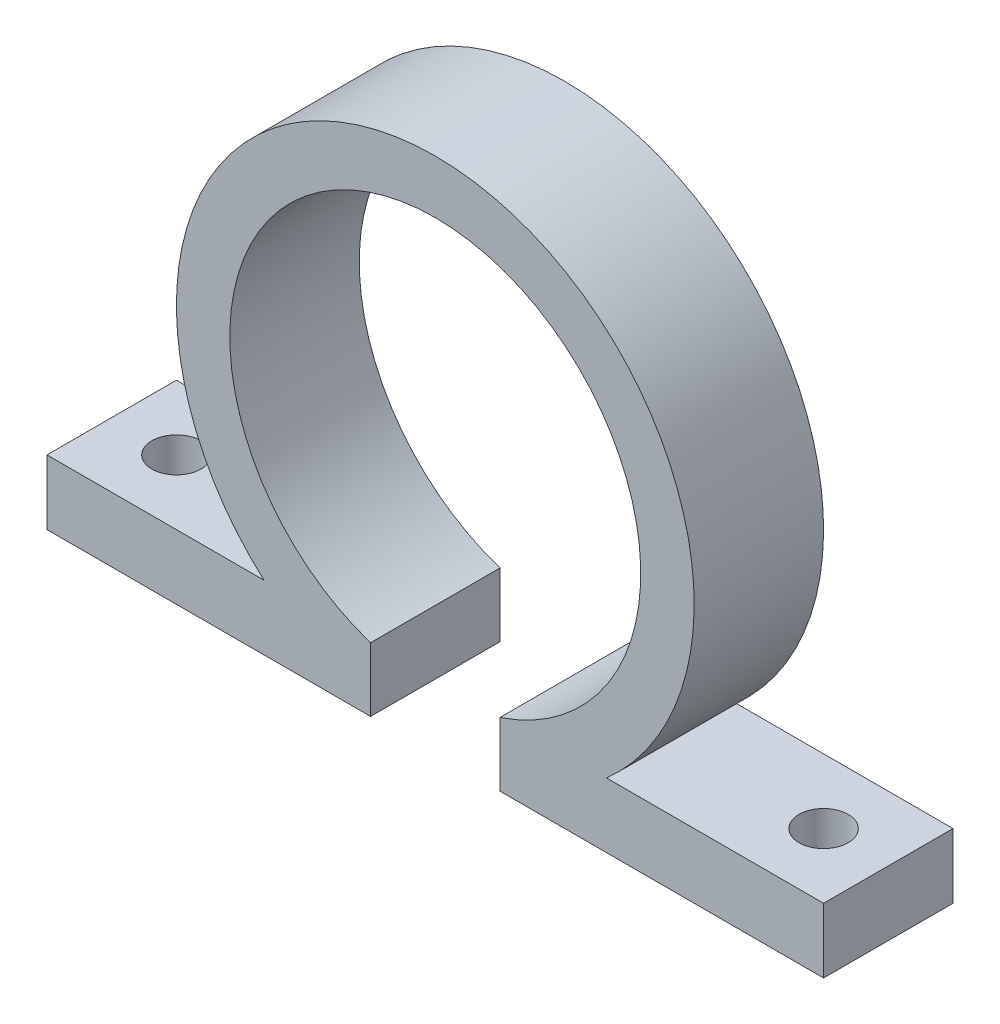
from build123d import *

# Parameters (mm, degrees)
SKETCH1_R             = 20
BOSS_EXTRUDE1_DEPTH   = 10
SKETCH2_W             = 60
SKETCH2_H             = 5
BOSS_EXTRUDE2_DEPTH   = 10
SKETCH3_R             = 15.875
CUT_EXTRUDE1_DEPTH    = 38.416573868
SKETCH4_W             = 10
SKETCH4_H             = 4.932962302
CUT_EXTRUDE2_DEPTH    = 38.416573868
F_6_CLEARANCE_HOLE1_D = 3.7973


with BuildPart() as part:
    # Sketch1 → Boss-Extrude1 (new body)
    with BuildSketch(Plane.XY):
        Circle(SKETCH1_R)
    extrude(amount=BOSS_EXTRUDE1_DEPTH)

    # Sketch2 → Boss-Extrude2 (add)
    with BuildSketch(Plane(origin=(0, 0, 0), x_dir=(-1, 0, 0), z_dir=(0, 0, -1))):
        with Locations((0, -17.5)):
            Rectangle(SKETCH2_W, SKETCH2_H)
    extrude(amount=-BOSS_EXTRUDE2_DEPTH)

    # Sketch3 → Cut-Extrude1 (cut, through all)
    with BuildSketch(Plane(origin=(0, 0, 0), x_dir=(-1, 0, 0), z_dir=(0, 0, -1))):
        Circle(SKETCH3_R)
    extrude(amount=-CUT_EXTRUDE1_DEPTH, mode=Mode.SUBTRACT)

    # Sketch4 → Cut-Extrude2 (cut, through all)
    with BuildSketch(Plane.XY.offset(10)):
        with Locations((0, -17.533518849)):
            Rectangle(SKETCH4_W, SKETCH4_H)
    extrude(amount=-CUT_EXTRUDE2_DEPTH, mode=Mode.SUBTRACT)

    # #6 Clearance Hole1 (through all)
    with Locations(Plane(origin=(0, -15, 0), x_dir=(1, 0, 0), z_dir=(0, 1, 0))):
        with Locations((-25, -5)):
            f_6_clearance_hole1 = Hole(F_6_CLEARANCE_HOLE1_D / 2)

    # Mirror1: #6 Clearance Hole1 across plane
    add(f_6_clearance_hole1.mirror(Plane(origin=(0, 0, 0), x_dir=(0, 0, 1), z_dir=(1, 0, 0))), mode=Mode.SUBTRACT)


solid = part.part
